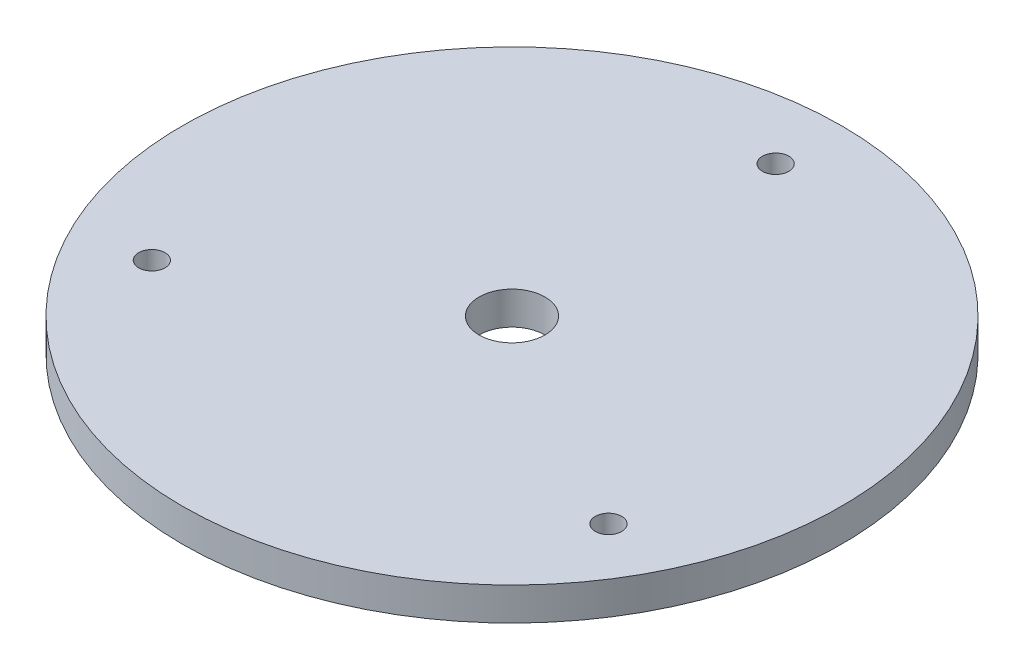
from build123d import *

# Parameters (mm, degrees)
CROQUIS1_R              = 100
CROQUIS1_R_2            = 10
CROQUIS1_R_3            = 4
SALIENTE_EXTRUIR1_DEPTH = 10


with BuildPart() as part:
    # Croquis1 → Saliente-Extruir1 (new body)
    with BuildSketch(Plane(origin=(0, 0, 0), x_dir=(1, 0, 0), z_dir=(0, 1, 0))):
        with Locations(Location((0, 0, 0), (0, 0, 270))):
            Circle(CROQUIS1_R)
        with Locations(Location((0, 0, 0), (0, 0, 270))):
            Circle(CROQUIS1_R_2, mode=Mode.SUBTRACT)
        with Locations(Location((-69.282032303, -40, 0), (0, 0, 270))):
            Circle(CROQUIS1_R_3, mode=Mode.SUBTRACT)
        with Locations(Location((69.282032303, -40, 0), (0, 0, 270))):
            Circle(CROQUIS1_R_3, mode=Mode.SUBTRACT)
        with Locations(Location((0, 80, 0), (0, 0, 270))):
            Circle(CROQUIS1_R_3, mode=Mode.SUBTRACT)
    extrude(amount=SALIENTE_EXTRUIR1_DEPTH)


solid = part.part
